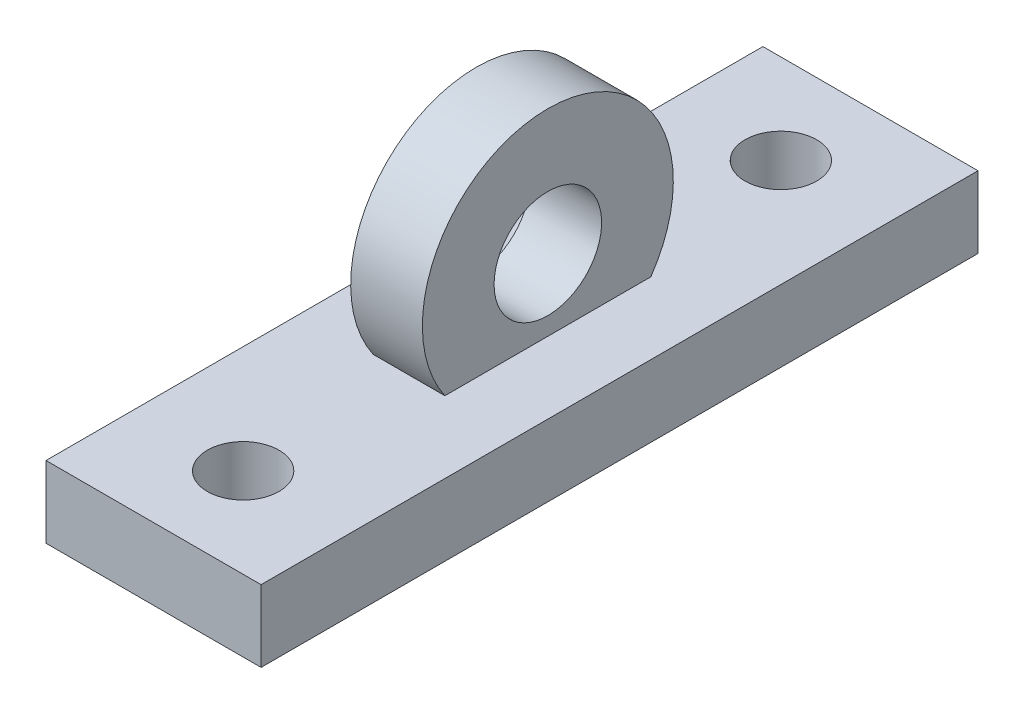
from build123d import *

# Parameters (mm, degrees)
SKETCH_4_W          = 6
SKETCH_4_H          = 20
EXTRUDE_1_DEPTH     = 2
EXTRUDE_START       = -2
SKETCH_6_R          = 3.5
SKETCH_6_R_2        = 1.5
EXTRUDE_3_DEPTH     = 2
SKETCH_7_R          = 1
CUT_EXTRUDE_1_DEPTH = 12.800423721


with BuildPart() as part:
    # 草图4 → 凸台-拉伸1 (new body)
    with BuildSketch(Plane(origin=(0, 0, 0), x_dir=(1, 0, 0), z_dir=(0, 1, 0))):
        Rectangle(SKETCH_4_W, SKETCH_4_H)
    extrude(amount=EXTRUDE_1_DEPTH)

    # 草图6 → 凸台-拉伸3 (add)
    with BuildSketch(Plane.ZY.offset(3).offset(EXTRUDE_START)):
        with Locations((0, 4)):
            Circle(SKETCH_6_R)
        with Locations((0, 4)):
            Circle(SKETCH_6_R_2, mode=Mode.SUBTRACT)
    extrude(amount=-EXTRUDE_3_DEPTH)

    # 草图7 → 切除-拉伸1 (cut, through all)
    with BuildSketch(Plane(origin=(0, 2, 0), x_dir=(1, 0, 0), z_dir=(0, 1, 0))):
        with Locations(Location((0, -7.5, 0), (0, 0, 270))):
            Circle(SKETCH_7_R)
        with Locations(Location((0, 7.5, 0), (0, 0, 270))):
            Circle(SKETCH_7_R)
    extrude(amount=-CUT_EXTRUDE_1_DEPTH, mode=Mode.SUBTRACT)


solid = part.part
